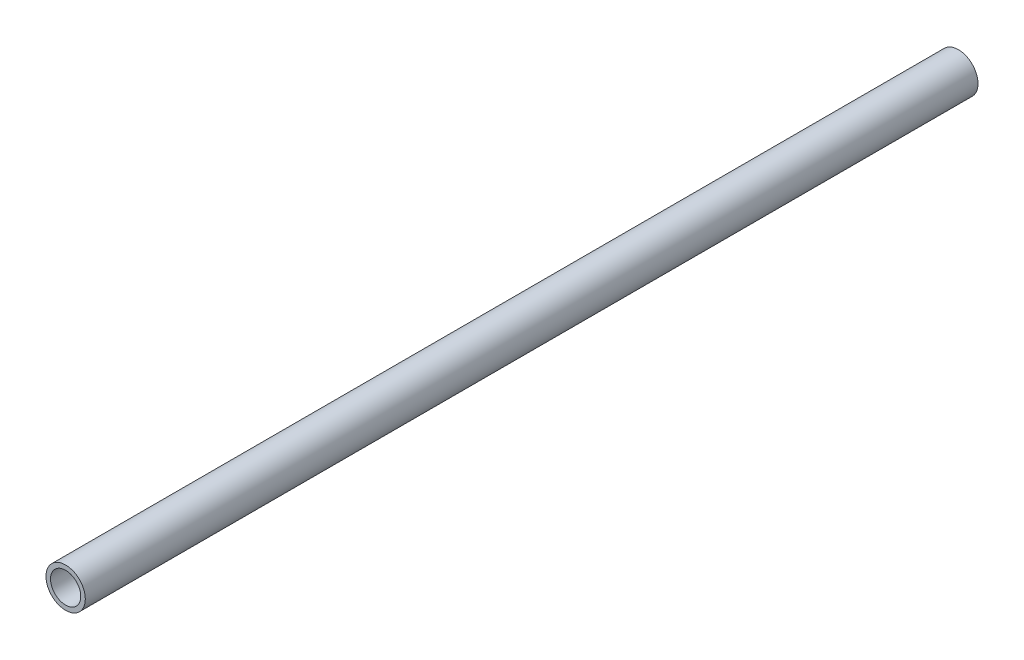
from build123d import *

# Parameters (mm, degrees)
SKETCH1_R           = 6.35
SKETCH1_R_2         = 4.8768
BOSS_EXTRUDE1_DEPTH = 288.29


with BuildPart() as part:
    # Sketch1 → Boss-Extrude1 (new body)
    with BuildSketch(Plane.XY):
        with Locations(Location((0, 0, 0), (0, 0, 191.03852135))):
            Circle(SKETCH1_R)
        with Locations(Location((0, 0, 0), (0, 0, 191.03852135))):
            Circle(SKETCH1_R_2, mode=Mode.SUBTRACT)
    extrude(amount=BOSS_EXTRUDE1_DEPTH)


solid = part.part
